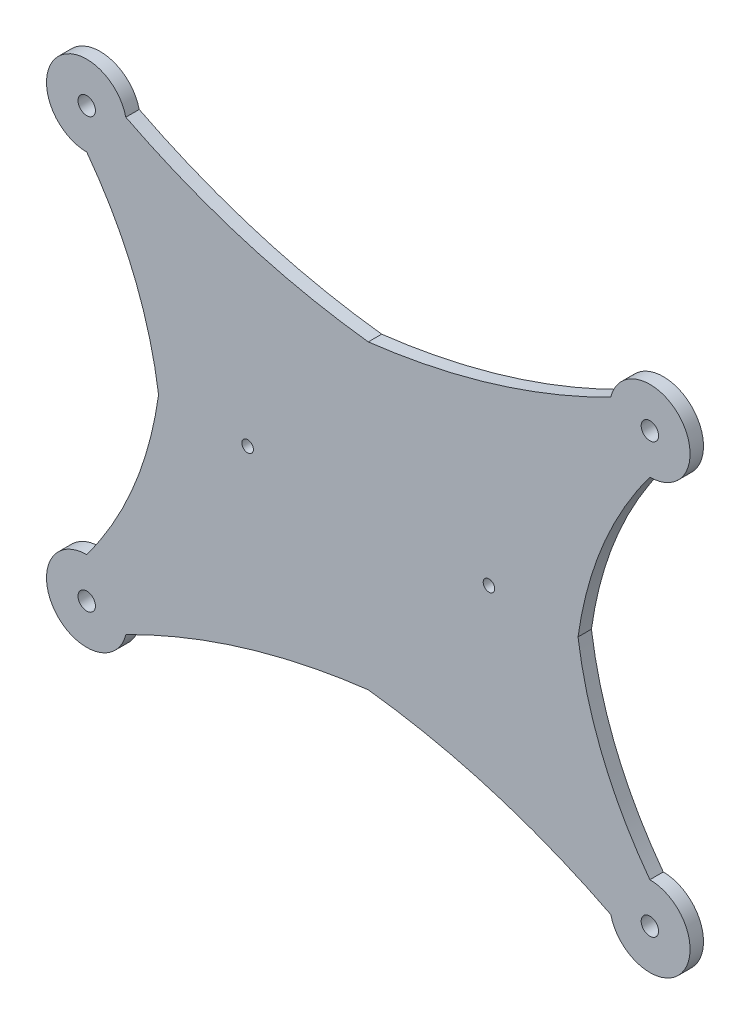
from build123d import *

# Parameters (mm, degrees)
SKETCH2_R           = 3.25
SKETCH2_R_2         = 2.15
BOSS_EXTRUDE1_DEPTH = 5


with BuildPart() as part:
    # Sketch2 → Boss-Extrude1 (new body)
    with BuildSketch(Plane.XY):
        with BuildLine():
            ThreePointArc((58.247868643, 87.353936938), (70.038600193, 111.62640422), (43.670645638, 105.890117005))
            add(Edge.make_bspline(
                [(43.670645638, 105.890117005), (15.172778081, 91.437929288), (-14.968147584, 82.320982869), (-46.752131357, 78.539277748)],
                knots=[0, 0, 0, 0, 1, 1, 1, 1], degree=3, weights=[1, 1, 1, 1]))
            add(Edge.make_bspline(
                [(-46.752131357, 78.539277748), (-78.53611513, 82.320982869), (-108.677040795, 91.437929288), (-137.174908352, 105.890117005)],
                knots=[0, 0, 0, 0, 1, 1, 1, 1], degree=3, weights=[1, 1, 1, 1]))
            ThreePointArc((-137.174908352, 105.890117005), (-163.542862908, 111.62640422), (-151.752131357, 87.353936938))
            add(Edge.make_bspline(
                [(-151.752131357, 87.353936938), (-137.251152171, 67.836975358), (-128.318856179, 46.170308692), (-124.955243383, 22.353936938)],
                knots=[0, 0, 0, 0, 1, 1, 1, 1], degree=3, weights=[1, 1, 1, 1]))
            add(Edge.make_bspline(
                [(-124.955243383, 22.353936938), (-128.318856179, -1.462434816), (-137.251152171, -23.129101482), (-151.752131357, -42.646063062)],
                knots=[0, 0, 0, 0, 1, 1, 1, 1], degree=3, weights=[1, 1, 1, 1]))
            ThreePointArc((-151.752131357, -42.646063062), (-163.542862908, -66.918530344), (-137.174908352, -61.182243129))
            add(Edge.make_bspline(
                [(-137.174908352, -61.182243129), (-108.677040795, -46.730055412), (-78.53611513, -37.613108993), (-46.752131357, -33.831403872)],
                knots=[0, 0, 0, 0, 1, 1, 1, 1], degree=3, weights=[1, 1, 1, 1]))
            add(Edge.make_bspline(
                [(-46.752131357, -33.831403872), (-14.968147584, -37.613108993), (15.172778081, -46.730055412), (43.670645638, -61.182243129)],
                knots=[0, 0, 0, 0, 1, 1, 1, 1], degree=3, weights=[1, 1, 1, 1]))
            ThreePointArc((43.670645638, -61.182243129), (70.038600194, -66.918530344), (58.247868643, -42.646063062))
            add(Edge.make_bspline(
                [(58.247868643, -42.646063062), (43.746889456, -23.129101482), (34.814593465, -1.462434816), (31.450980669, 22.353936938)],
                knots=[0, 0, 0, 0, 1, 1, 1, 1], degree=3, weights=[1, 1, 1, 1]))
            add(Edge.make_bspline(
                [(31.450980669, 22.353936938), (34.814593465, 46.170308692), (43.746889456, 67.836975358), (58.247868643, 87.353936938)],
                knots=[0, 0, 0, 0, 1, 1, 1, 1], degree=3, weights=[1, 1, 1, 1]))
        make_face()
        with Locations((-151.752131357, 102.353936938)):
            Circle(SKETCH2_R, mode=Mode.SUBTRACT)
        with Locations((58.247868643, -57.646063062)):
            Circle(SKETCH2_R, mode=Mode.SUBTRACT)
        with Locations((58.247868643, 102.353936938)):
            Circle(SKETCH2_R, mode=Mode.SUBTRACT)
        with Locations((-1.752131357, 22.353936938)):
            Circle(SKETCH2_R_2, mode=Mode.SUBTRACT)
        with Locations((-91.752131357, 22.353936938)):
            Circle(SKETCH2_R_2, mode=Mode.SUBTRACT)
        with Locations((-151.752131357, -57.646063062)):
            Circle(SKETCH2_R, mode=Mode.SUBTRACT)
    extrude(amount=BOSS_EXTRUDE1_DEPTH)


solid = part.part
